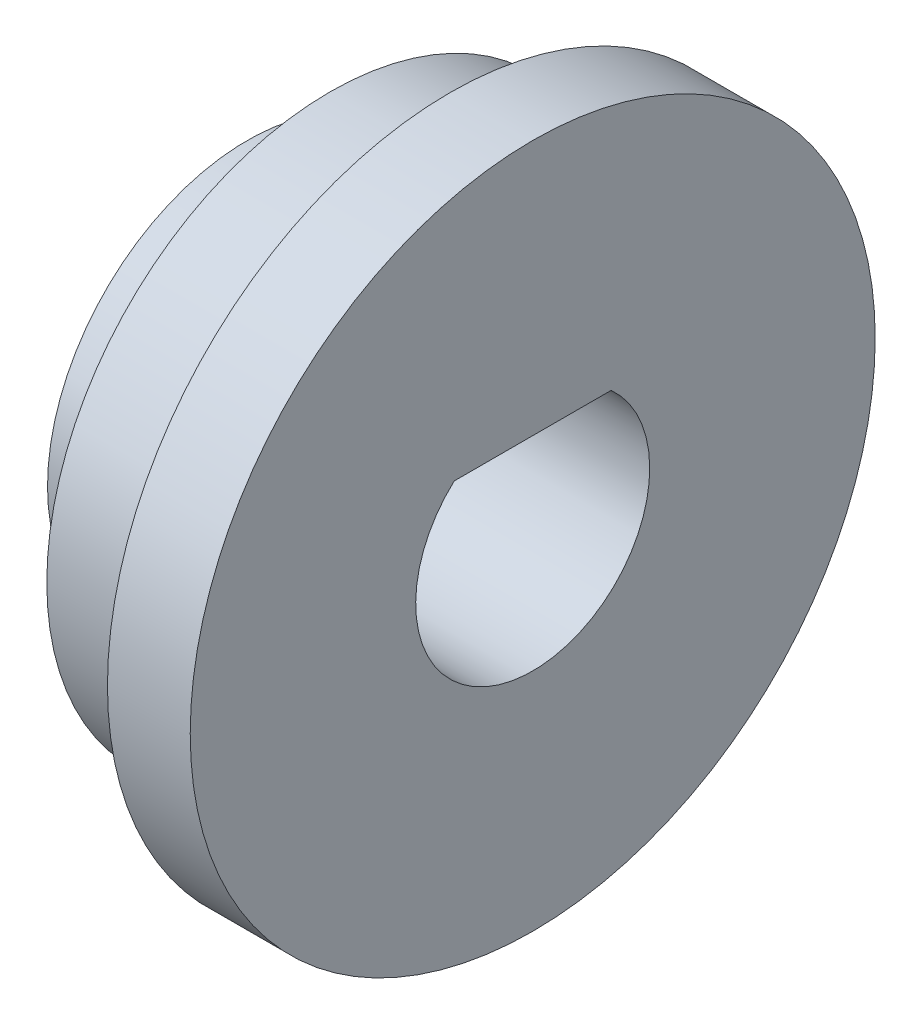
from build123d import *

# Parameters (mm, degrees)
SCHNITT_LINEAR_AUSTRAGEN1_DEPTH = 20.697715604


with BuildPart() as part:
    # Skizze1 → Rotation1 (revolve)
    with BuildSketch(Plane.XY, mode=Mode.PRIVATE) as rotation1_sk:
        Polygon((0, 0), (0, 7), (2.9, 7), (2.9, 9.925), (7.1, 9.925), (7.1, 12), (10, 12), (10, 0), align=None)
    revolve(rotation1_sk.sketch.rotate(Axis((0, 0, 0), (-1, 0, 0)), 90), axis=Axis((0, 0, 0), (-1, 0, 0)))

    # Skizze2 → Schnitt-Linear austragen1 (cut, through all)
    with BuildSketch(Plane.ZY):
        with BuildLine():
            Line((-2.75, 3.04097024), (2.75, 3.04097024))
            ThreePointArc((2.75, 3.04097024), (0, -4.1), (-2.75, 3.04097024))
        make_face()
    extrude(amount=-SCHNITT_LINEAR_AUSTRAGEN1_DEPTH, mode=Mode.SUBTRACT)


solid = part.part
